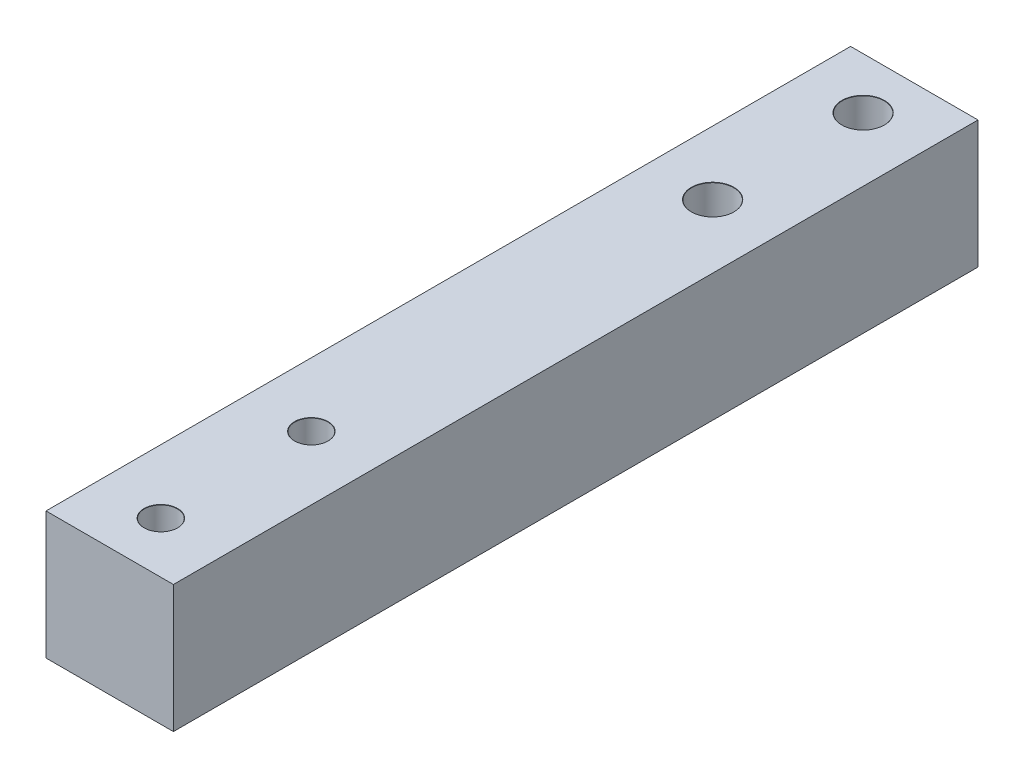
from build123d import *

# Parameters (mm, degrees)
SKETCH_1_W                   = 12.7
SKETCH_1_H                   = 12.7
EXTRUDE_1_DEPTH              = 80.2
HOLE_WIZARD_M4_1_D           = 3.3
HOLE_WIZARD_M4_1_CSINK_D     = 3.35
HOLE_WIZARD_M4_1_CSINK_ANGLE = 90
HOLE_WIZARD_M5_1_D           = 4.2
HOLE_WIZARD_M5_1_CSINK_D     = 4.25
HOLE_WIZARD_M5_1_CSINK_ANGLE = 90


with BuildPart() as part:
    # 草圖1 → 填料-伸長1 (new body)
    with BuildSketch(Plane.XY):
        Rectangle(SKETCH_1_W, SKETCH_1_H)
    extrude(amount=EXTRUDE_1_DEPTH)

    # M4  螺絲攻的螺孔鑽1 (through all)
    with Locations(Plane(origin=(0, 6.35, 0), x_dir=(1, 0, 0), z_dir=(0, 1, 0))):
        with Locations((0, -60.1), (0, -75.1)):
            CounterSinkHole(HOLE_WIZARD_M4_1_D / 2, HOLE_WIZARD_M4_1_CSINK_D / 2, counter_sink_angle=HOLE_WIZARD_M4_1_CSINK_ANGLE)

    # M5  螺絲攻的螺孔鑽1 (through all)
    with Locations(Plane(origin=(0, 6.35, 0), x_dir=(1, 0, 0), z_dir=(0, 1, 0))):
        with Locations((0, -5.1), (0, -20.1)):
            CounterSinkHole(HOLE_WIZARD_M5_1_D / 2, HOLE_WIZARD_M5_1_CSINK_D / 2, counter_sink_angle=HOLE_WIZARD_M5_1_CSINK_ANGLE)


solid = part.part
